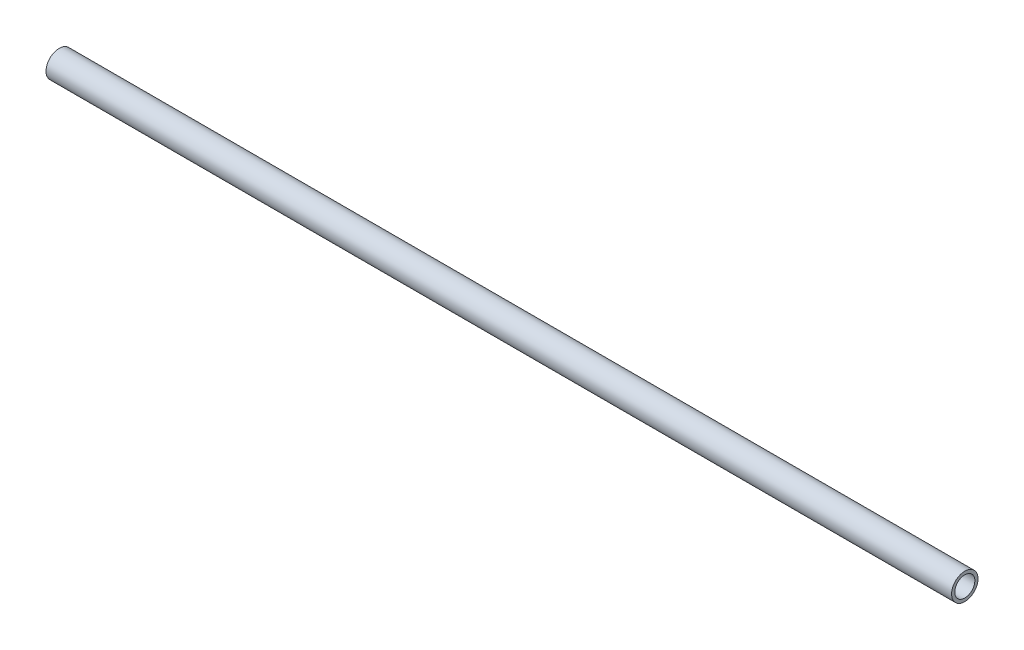
from build123d import *

# Parameters (mm, degrees)
SKETCH1_R           = 12.7
SKETCH1_R_2         = 9.652
BOSS_EXTRUDE1_DEPTH = 870


with BuildPart() as part:
    # Sketch1 → Boss-Extrude1 (new body)
    with BuildSketch(Plane(origin=(0, 0, 0), x_dir=(0, 0, -1), z_dir=(1, 0, 0))):
        with Locations(Location((0, 0, 0), (0, 0, 180))):
            Circle(SKETCH1_R)
        with Locations(Location((0, 0, 0), (0, 0, 180))):
            Circle(SKETCH1_R_2, mode=Mode.SUBTRACT)
    extrude(amount=BOSS_EXTRUDE1_DEPTH)


solid = part.part
